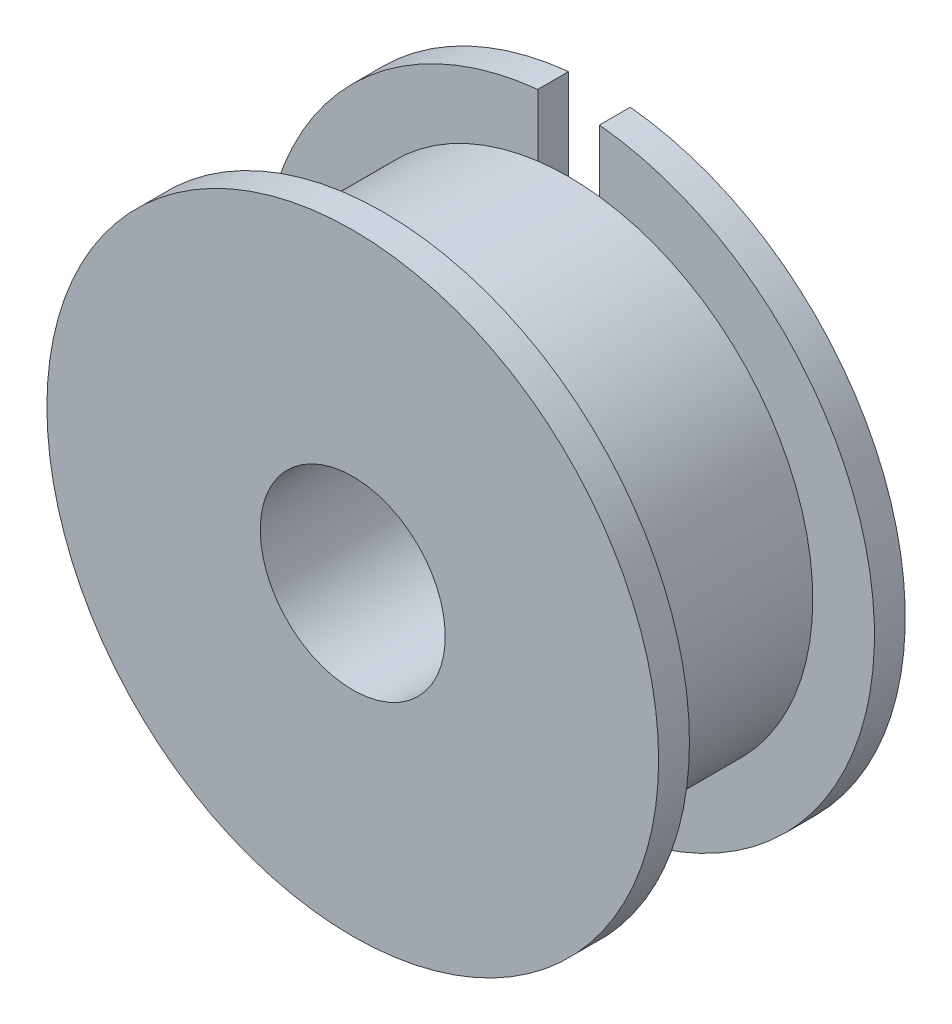
from build123d import *

# Parameters (mm, degrees)
CUT_EXTRUDE1_DEPTH = 1.5875


with BuildPart() as part:
    # Sketch1 → Revolve1 (revolve)
    with BuildSketch(Plane(origin=(-44.322460282, 0, 0), x_dir=(0, 0, -1), z_dir=(1, 0, 0)), mode=Mode.PRIVATE) as revolve1_sk:
        Polygon((11.1125, -13.31199997), (9.525, -13.31199997), (9.525, -24.29749997), (22.225, -24.29749997), (22.225, -13.31199997), (20.6375, -13.31199997), (20.6375, -16.48699997), (11.1125, -16.48699997), align=None)
    revolve(revolve1_sk.sketch.rotate(Axis((-44.322460282, -29.05999997, -22.225), (0, 0, 1)), 90), axis=Axis((-44.322460282, -29.05999997, -22.225), (0, 0, 1)))

    # Sketch2 → Cut-Extrude1 (cut)
    with BuildSketch(Plane(origin=(0, 0, -22.225), x_dir=(-1, 0, 0), z_dir=(0, 0, -1))):
        with BuildLine():
            Line((45.909960282, -13.31199997), (45.909960282, -19.66199997))
            ThreePointArc((45.909960282, -19.66199997), (44.322460282, -21.24949997), (42.734960282, -19.66199997))
            Line((42.734960282, -19.66199997), (42.734960282, -13.31199997))
            ThreePointArc((42.734960282, -13.31199997), (44.322460282, -11.72449997), (45.909960282, -13.31199997))
        make_face()
    extrude(amount=-CUT_EXTRUDE1_DEPTH, mode=Mode.SUBTRACT)


solid = part.part
